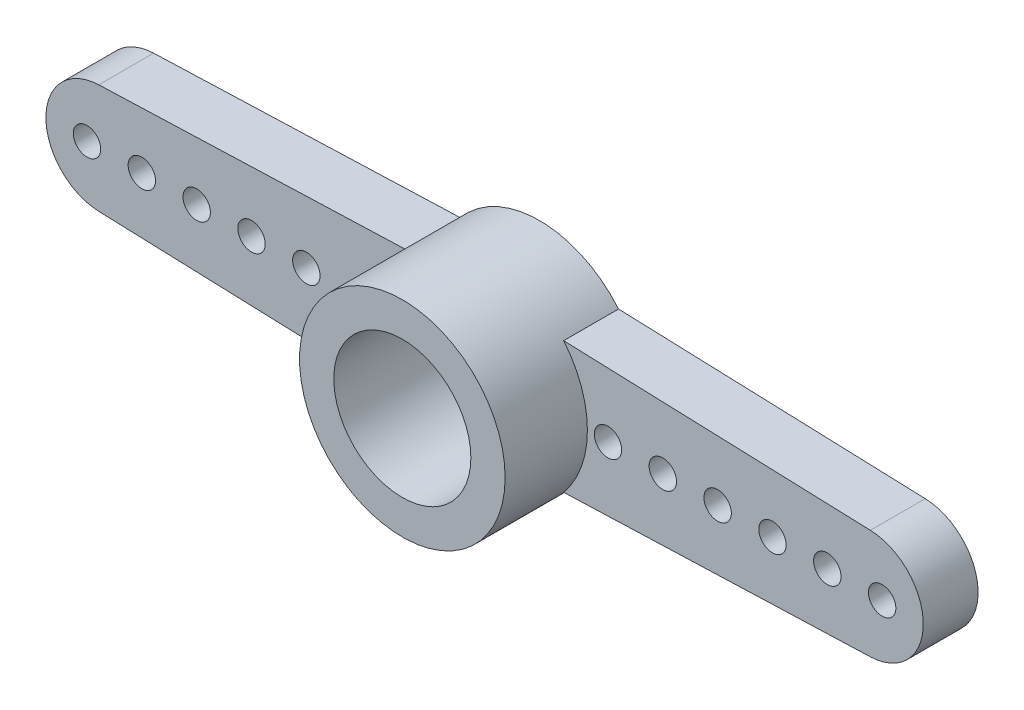
from build123d import *

# Parameters (mm, degrees)
EXTRUDE_3_DEPTH     = 2
EXTRUDE_3_2_DEPTH   = 2
SKETCH_2_R          = 3.75
SKETCH_2_R_2        = 2.5
EXTRUDE_5_DEPTH     = 3
EXTRUDE_START       = 2
SKETCH_3_R          = 3.75
SKETCH_3_R_2        = 2.5
EXTRUDE_6_DEPTH     = 2
SKETCH_4_R          = 0.5
CUT_EXTRUDE_1_DEPTH = 2
SKETCH_5_R          = 2.5
EXTRUDE_7_DEPTH     = 1
SKETCH_6_R          = 2.5
CUT_EXTRUDE_2_DEPTH = 0.5
SKETCH_7_R          = 1.25
CUT_EXTRUDE_3_DEPTH = 5


with BuildPart() as part:
    # Эскиз1 → Бобышка-Вытянуть3 (new body)
    with BuildSketch(Plane.XY):
        with BuildLine():
            ThreePointArc((-2.88547071, -2.395111434), (-3.527252129, -1.273182005), (-3.75, 0))
            ThreePointArc((-3.75, 0), (-3.527252129, 1.273182005), (-2.88547071, 2.395111434))
            Line((-2.88547071, 2.395111434), (-14.07082784, 1.998745461))
            ThreePointArc((-14.07082784, 1.998745461), (-16, 0), (-14.07082784, -1.998745461))
            Line((-14.07082784, -1.998745461), (-2.88547071, -2.395111434))
        make_face()
    extrude(amount=EXTRUDE_3_DEPTH)



with BuildPart() as body_2:
    # Эскиз1 → Extrude 3 2 (new body)
    with BuildSketch(Plane.XY):
        with BuildLine():
            Line((14.07082784, 1.998745461), (2.88547071, 2.395111434))
            ThreePointArc((2.88547071, 2.395111434), (3.75, 0), (2.88547071, -2.395111434))
            Line((2.88547071, -2.395111434), (14.07082784, -1.998745461))
            ThreePointArc((14.07082784, -1.998745461), (16, 0), (14.07082784, 1.998745461))
        make_face()
    extrude(amount=EXTRUDE_3_2_DEPTH)


with BuildPart() as body_3:
    # Эскиз2 → Бобышка-Вытянуть5 (new body)
    with BuildSketch(Plane.XY.offset(2)):
        Circle(SKETCH_2_R)
        Circle(SKETCH_2_R_2, mode=Mode.SUBTRACT)
    extrude(amount=EXTRUDE_5_DEPTH)


with BuildPart() as part_1:
    add(part.part)

    add(body_2.part)  # Бобышка-Вытянуть6 merges body 2

    add(body_3.part)  # Бобышка-Вытянуть6 merges body 3
    # Эскиз3 → Бобышка-Вытянуть6 (add)
    with BuildSketch(Plane(origin=(0, 0, 2), x_dir=(-1, 0, 0), z_dir=(0, 0, -1)).offset(EXTRUDE_START)):
        with Locations(Location((0, 0, 0), (0, 0, 180))):
            Circle(SKETCH_3_R)
        with Locations(Location((0, 0, 0), (0, 0, 180))):
            Circle(SKETCH_3_R_2, mode=Mode.SUBTRACT)
    extrude(amount=-EXTRUDE_6_DEPTH)

    # Эскиз4 → Вырез-Вытянуть1 (cut)
    with BuildSketch(Plane(origin=(0, 0, 0), x_dir=(-1, 0, 0), z_dir=(0, 0, -1))):
        with Locations((-14.5, 0)):
            Circle(SKETCH_4_R)
        with Locations((-4.5, 0)):
            Circle(SKETCH_4_R)
        with Locations((-6.5, 0)):
            Circle(SKETCH_4_R)
        with Locations((-8.5, 0)):
            Circle(SKETCH_4_R)
        with Locations((-10.5, 0)):
            Circle(SKETCH_4_R)
        with Locations((-12.5, 0)):
            Circle(SKETCH_4_R)
        with Locations((4.5, 0)):
            Circle(SKETCH_4_R)
        with Locations((6.5, 0)):
            Circle(SKETCH_4_R)
        with Locations((8.5, 0)):
            Circle(SKETCH_4_R)
        with Locations((10.5, 0)):
            Circle(SKETCH_4_R)
        with Locations((12.5, 0)):
            Circle(SKETCH_4_R)
        with Locations((14.5, 0)):
            Circle(SKETCH_4_R)
    extrude(amount=-CUT_EXTRUDE_1_DEPTH, mode=Mode.SUBTRACT)

    # Эскиз5 → Бобышка-Вытянуть7 (add)
    with BuildSketch(Plane(origin=(0, 0, 0), x_dir=(-1, 0, 0), z_dir=(0, 0, -1))):
        with Locations(Location((0, 0, 0), (0, 0, 180))):
            Circle(SKETCH_5_R)
    extrude(amount=-EXTRUDE_7_DEPTH)

    # Эскиз6 → Вырез-Вытянуть2 (cut)
    with BuildSketch(Plane(origin=(0, 0, 0), x_dir=(-1, 0, 0), z_dir=(0, 0, -1))):
        with Locations(Location((0, 0, 0), (0, 0, 180))):
            Circle(SKETCH_6_R)
    extrude(amount=-CUT_EXTRUDE_2_DEPTH, mode=Mode.SUBTRACT)

    # Эскиз7 → Вырез-Вытянуть3 (cut)
    with BuildSketch(Plane(origin=(0, 0, 0.5), x_dir=(-1, 0, 0), z_dir=(0, 0, -1))):
        Circle(SKETCH_7_R)
    extrude(amount=-CUT_EXTRUDE_3_DEPTH, mode=Mode.SUBTRACT)


solid = part_1.part
